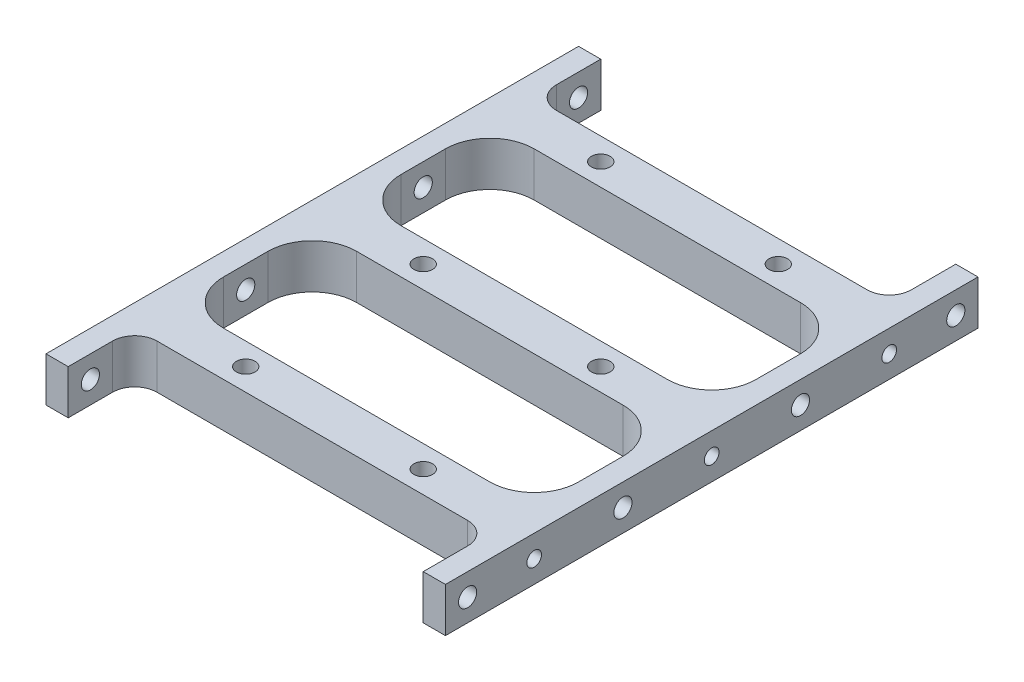
from build123d import *

# Parameters (mm, degrees)
EXTRUDE_1_DEPTH             = 5
SKETCH_2_R                  = 2.05
CUT_EXTRUDE_1_DEPTH         = 109.282039139
HOLE_WIZARD_M4_2_AT_2_COUNT = 2
HOLE_WIZARD_M4_2_AT_2_PITCH = 40
HOLE_WIZARD_M4_2_AT_3_COUNT = 2
HOLE_WIZARD_M4_2_AT_3_PITCH = 40
FILLET_1_R                  = 5
HOLE_WIZARD_M5_1_D          = 4.2


with BuildPart() as part:
    # 草图1 → 凸台-拉伸1 (new, symmetric)
    with BuildSketch(Plane(origin=(0, 0, 0), x_dir=(1, 0, 0), z_dir=(0, 1, 0))):
        Polygon((-45, 60), (-40, 60), (-40, 45), (40, 45), (40, 60), (45, 60), (45, -60), (40, -60), (40, -45), (-40, -45), (-40, -60), (-45, -60), align=None)
        with BuildLine():
            Line((-30, 5), (30, 5))
            ThreePointArc((30, 5), (37.071067812, 7.928932188), (40, 15))
            Line((40, 15), (40, 25))
            ThreePointArc((40, 25), (37.071067812, 32.071067812), (30, 35))
            Line((30, 35), (-30, 35))
            ThreePointArc((-30, 35), (-37.071067812, 32.071067812), (-40, 25))
            Line((-40, 25), (-40, 15))
            ThreePointArc((-40, 15), (-37.071067812, 7.928932188), (-30, 5))
        make_face(mode=Mode.SUBTRACT)
        with BuildLine():
            Line((30, -5), (-30, -5))
            ThreePointArc((-30, -5), (-37.071067812, -7.928932188), (-40, -15))
            Line((-40, -15), (-40, -25))
            ThreePointArc((-40, -25), (-37.071067812, -32.071067812), (-30, -35))
            Line((-30, -35), (30, -35))
            ThreePointArc((30, -35), (37.071067812, -32.071067812), (40, -25))
            Line((40, -25), (40, -15))
            ThreePointArc((40, -15), (37.071067812, -7.928932188), (30, -5))
        make_face(mode=Mode.SUBTRACT)
    extrude(amount=EXTRUDE_1_DEPTH, both=True)

    # 草图2 → 切除-拉伸1 (cut, through all)
    with BuildSketch(Plane.ZY.offset(45)):
        with Locations((-55, 0)):
            Circle(SKETCH_2_R)
        with Locations((55, 0)):
            Circle(SKETCH_2_R)
        with Locations((-20, 0)):
            Circle(SKETCH_2_R)
        with Locations((20, 0)):
            Circle(SKETCH_2_R)
    extrude(amount=-CUT_EXTRUDE_1_DEPTH, mode=Mode.SUBTRACT)

    # 草图6 → M4 螺纹孔2 (revolve, cut)
    with BuildSketch(Plane(origin=(-45, 0, 0), x_dir=(0, 0, 1), z_dir=(0, 1, 0))):
        Polygon((0, 0), (0, 18.091420021), (1.65, 17.1), (1.65, 0), align=None)
    hole_wizard_m4_2 = revolve(axis=Axis((-51.35, 0, 0), (1, 0, 0)), mode=Mode.SUBTRACT)

    # M4 螺纹孔2 at 2: M4 螺纹孔2 ×2
    with Locations(*[(0, 0, -i * HOLE_WIZARD_M4_2_AT_2_PITCH) for i in range(1, HOLE_WIZARD_M4_2_AT_2_COUNT)]):
        add(hole_wizard_m4_2, mode=Mode.SUBTRACT)

    # M4 螺纹孔2 at 3: M4 螺纹孔2 ×2
    with Locations(*[(0, 0, i * HOLE_WIZARD_M4_2_AT_3_PITCH) for i in range(1, HOLE_WIZARD_M4_2_AT_3_COUNT)]):
        add(hole_wizard_m4_2, mode=Mode.SUBTRACT)

    # 镜向1: M4 螺纹孔2 across plane
    add(hole_wizard_m4_2.mirror(Plane(origin=(0, 0, 0), x_dir=(0, 0, 1), z_dir=(1, 0, 0))), mode=Mode.SUBTRACT)

    # 镜向1 copy 1 sketch → 镜向1 copy 1 (revolve, cut)
    with BuildSketch(Plane(origin=(45, 0, -40), x_dir=(0, 0, 1), z_dir=(0, 1, 0))):
        Polygon((0, 0), (0, -18.091420021), (1.65, -17.1), (1.65, 0), align=None)
    revolve(axis=Axis((51.35, 0, -40), (1, 0, 0)), mode=Mode.SUBTRACT)

    # 镜向1 copy 2 sketch → 镜向1 copy 2 (revolve, cut)
    with BuildSketch(Plane(origin=(45, 0, 40), x_dir=(0, 0, 1), z_dir=(0, 1, 0))):
        Polygon((0, 0), (0, -18.091420021), (1.65, -17.1), (1.65, 0), align=None)
    revolve(axis=Axis((51.35, 0, 40), (1, 0, 0)), mode=Mode.SUBTRACT)

    # 圆角1
    fillet_1_edges = [part.edges().sort_by_distance(p)[0] for p in [
        (-40, 0, -45),
        (40, 0, -45),
        (40, 0, 45),
        (-40, 0, 45),
    ]]
    fillet(fillet_1_edges, radius=FILLET_1_R)

    # M5 螺纹孔1 (through all)
    with Locations(Plane(origin=(0, 5, 0), x_dir=(1, 0, 0), z_dir=(0, 1, 0))):
        with Locations((20, 40), (20, 0), (20, -40), (-20, -40), (-20, 0), (-20, 40)):
            Hole(HOLE_WIZARD_M5_1_D / 2)


solid = part.part
